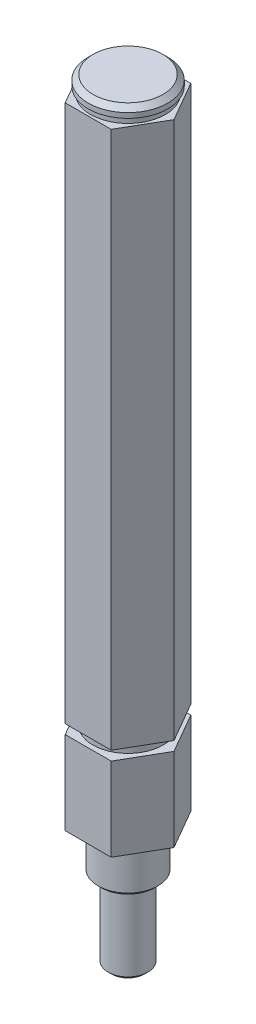
from build123d import *

# Parameters (mm, degrees)
BOSS_EXTRUDE1_DEPTH = 10.6172
SKETCH2_R           = 5.588
BOSS_EXTRUDE2_DEPTH = 1.4986
BOSS_EXTRUDE3_DEPTH = 13.2842
SKETCH4_R           = 4.7498
BOSS_EXTRUDE4_DEPTH = 7.112
BOSS_EXTRUDE7_DEPTH = 134.62
SKETCH5_R           = 3.1623
BOSS_EXTRUDE5_DEPTH = 12.7
CHAMFER1_SIZE       = 0.508
CHAMFER2_SIZE       = 0.508
CUT_EXTRUDE2_START  = -59.4614
CUT_EXTRUDE2_DEPTH  = 59.4614
SKETCH12_R          = 5.9436
BOSS_EXTRUDE8_DEPTH = 0.9906
SKETCH13_R          = 6.35
BOSS_EXTRUDE9_DEPTH = 1.5875
CHAMFER3_SIZE       = 0.79375


with BuildPart() as part:
    # Sketch1 → Boss-Extrude1 (new body)
    with BuildSketch(Plane(origin=(0, 0, 0), x_dir=(1, 0, 0), z_dir=(0, 1, 0))):
        Polygon((-34.640959507, 23.019011646), (-41.973307925, 23.019011646), (-45.639482135, 16.669011646), (-41.973307925, 10.319011646), (-34.640959507, 10.319011646), (-30.974785297, 16.669011646), align=None)
    extrude(amount=-BOSS_EXTRUDE1_DEPTH)

    # Sketch2 → Boss-Extrude2 (add)
    with BuildSketch(Plane.XZ.offset(10.6172)):
        with Locations(Location((-38.307133716, -16.669011646, 0), (0, 0, 90))):
            Circle(SKETCH2_R)
    extrude(amount=BOSS_EXTRUDE2_DEPTH)

    # Sketch3 → Boss-Extrude3 (add)
    with BuildSketch(Plane(origin=(0, -12.1158, 0), x_dir=(-1, 0, 0), z_dir=(0, 1, 0))):
        Polygon((41.973307925, -23.019011646), (45.639482135, -16.669011646), (41.973307925, -10.319011646), (34.640959507, -10.319011646), (30.974785297, -16.669011646), (34.640959507, -23.019011646), align=None)
    extrude(amount=-BOSS_EXTRUDE3_DEPTH)

    # Sketch4 → Boss-Extrude4 (add)
    with BuildSketch(Plane.XZ.offset(25.4)):
        with Locations(Location((-38.307133716, -16.669011646, 0), (0, 0, 90))):
            Circle(SKETCH4_R)
    extrude(amount=BOSS_EXTRUDE4_DEPTH)

    # Sketch10 → Boss-Extrude7 (add)
    with BuildSketch(Plane(origin=(0, 0, 0), x_dir=(1, 0, 0), z_dir=(0, 1, 0))):
        Polygon((-30.974785297, 16.669011646), (-34.640959507, 23.019011646), (-41.973307925, 23.019011646), (-45.639482135, 16.669011646), (-41.973307925, 10.319011646), (-34.640959507, 10.319011646), align=None)
    extrude(amount=BOSS_EXTRUDE7_DEPTH)

    # Sketch5 → Boss-Extrude5 (add)
    with BuildSketch(Plane.XZ.offset(32.512)):
        with Locations(Location((-38.307133716, -16.669011646, 0), (0, 0, 270))):
            Circle(SKETCH5_R)
    extrude(amount=BOSS_EXTRUDE5_DEPTH)

    # Chamfer1
    chamfer1_edges = [part.edges().sort_by_distance(p)[0] for p in [
        (-38.307133716, -45.212, -13.506711646),
    ]]
    chamfer(chamfer1_edges, length=CHAMFER1_SIZE)

    # Chamfer2
    chamfer2_edges = [part.edges().sort_by_distance(p)[0] for p in [
        (-38.307133716, -32.512, -21.418811646),
    ]]
    chamfer(chamfer2_edges, length=CHAMFER2_SIZE)

    # Sketch11 → Cut-Extrude2 (cut)
    with BuildSketch(Plane(origin=(0, 134.62, 0), x_dir=(1, 0, 0), z_dir=(0, 1, 0)).offset(CUT_EXTRUDE2_START)):
        Polygon((-34.640959507, 10.319011646), (-30.974785297, 16.669011646), (-34.640959507, 23.019011646), (-41.973307925, 23.019011646), (-45.639482135, 16.669011646), (-41.973307925, 10.319011646), align=None)
    extrude(amount=CUT_EXTRUDE2_DEPTH, mode=Mode.SUBTRACT)

    # Sketch12 → Boss-Extrude8 (add)
    with BuildSketch(Plane(origin=(0, 75.1586, 0), x_dir=(1, 0, 0), z_dir=(0, 1, 0))):
        with Locations((-38.307133716, 16.669011646)):
            Circle(SKETCH12_R)
    extrude(amount=BOSS_EXTRUDE8_DEPTH)

    # Sketch13 → Boss-Extrude9 (add)
    with BuildSketch(Plane(origin=(0, 76.1492, 0), x_dir=(1, 0, 0), z_dir=(0, 1, 0))):
        with Locations(Location((-38.307133716, 16.669011646, 0), (0, 0, 180))):
            Circle(SKETCH13_R)
    extrude(amount=BOSS_EXTRUDE9_DEPTH)

    # Chamfer3
    chamfer3_edges = [part.edges().sort_by_distance(p)[0] for p in [
        (-31.957133716, 77.7367, -16.669011646),
    ]]
    chamfer(chamfer3_edges, length=CHAMFER3_SIZE)


solid = part.part
